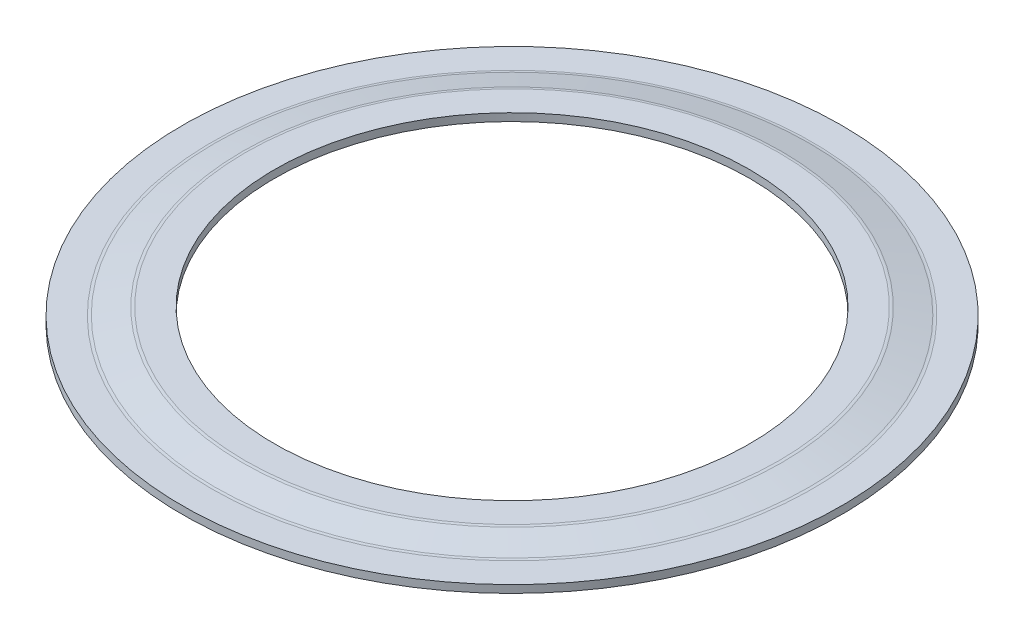
from build123d import *

# Parameters (mm, degrees)
FILLET1_R = 0.75


with BuildPart() as part:
    # Sketch1 → Revolve1 (revolve)
    with BuildSketch(Plane(origin=(0, 0, 0), x_dir=(0, 0, -1), z_dir=(1, 0, 0))):
        Polygon((15.5, 0.5), (17.5, 0.5), (19.5, 0), (21.5, 0), (21.5, -0.5), (19.5, -0.5), (17.5, 0), (15.5, 0), align=None)
    revolve(axis=Axis((0, 0, 0), (0, 1, 0)))

    # Fillet1
    fillet1_edges = [part.edges().sort_by_distance(p)[0] for p in [
        (0, 0, 17.5),
        (0, -0.5, 19.5),
        (0, 0, 19.5),
        (0, 0.5, 17.5),
    ]]
    fillet(fillet1_edges, radius=FILLET1_R)


solid = part.part
